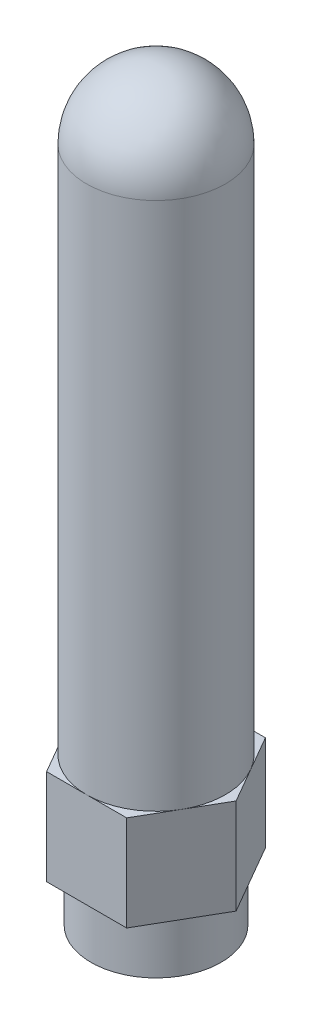
from build123d import *

# Parameters (mm, degrees)
BOSS_EXTRUDE1_DEPTH = 5.5
SKETCH3_R           = 3.75
BOSS_EXTRUDE2_DEPTH = 3
SKETCH4_R           = 3
CUT_EXTRUDE1_DEPTH  = 8


with BuildPart() as part:
    # Sketch1 → Revolve1 (revolve)
    with BuildSketch(Plane.XY):
        with BuildLine():
            Line((0, 0), (4, 0))
            Line((4, 0), (4, 36))
            ThreePointArc((4, 36), (2.828427125, 38.828427125), (0, 40))
            Line((0, 40), (0, 0))
        make_face()
    revolve(axis=Axis((0, 0, 0), (0, 1, 0)))

    # Sketch2 → Boss-Extrude1 (add)
    with BuildSketch(Plane(origin=(0, 0, 0), x_dir=(1, 0, 0), z_dir=(0, 1, 0))):
        Polygon((4.618802154, 0), (2.309401077, 4), (-2.309401077, 4), (-4.618802154, 0), (-2.309401077, -4), (2.309401077, -4), align=None)
    extrude(amount=BOSS_EXTRUDE1_DEPTH)

    # Sketch3 → Boss-Extrude2 (add)
    with BuildSketch(Plane.XZ):
        with Locations(Location((0, 0, 0), (0, 0, 270))):
            Circle(SKETCH3_R)
    extrude(amount=BOSS_EXTRUDE2_DEPTH)

    # Sketch4 → Cut-Extrude1 (cut)
    with BuildSketch(Plane.XZ.offset(3)):
        with Locations(Location((0, 0, 0), (0, 0, 270))):
            Circle(SKETCH4_R)
    extrude(amount=-CUT_EXTRUDE1_DEPTH, mode=Mode.SUBTRACT)


solid = part.part
